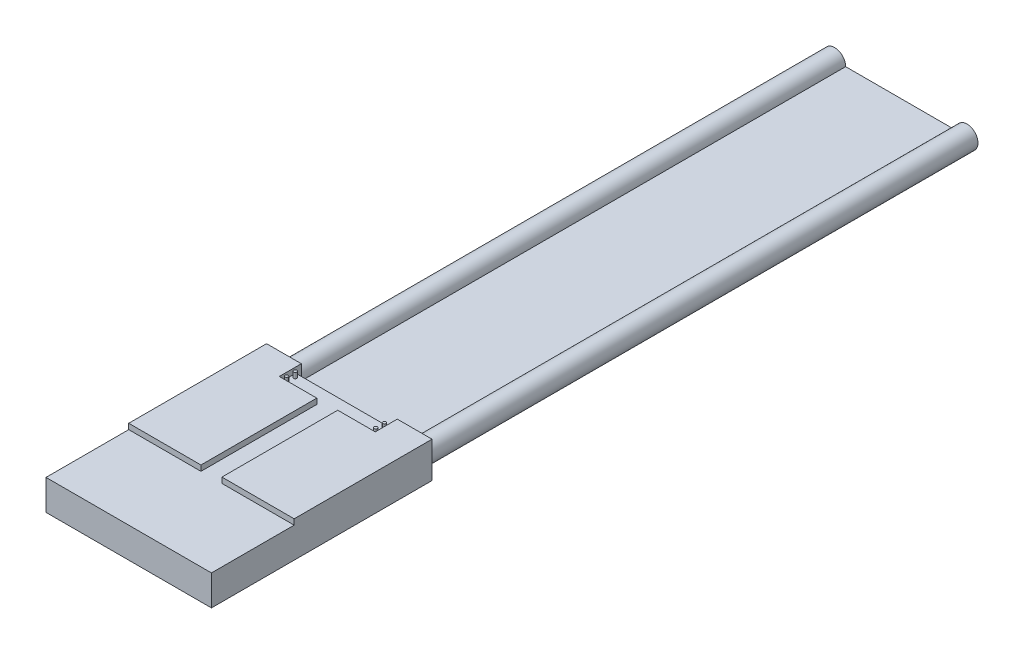
from build123d import *

# Parameters (mm, degrees)
SKETCH1_W            = 30
SKETCH1_H            = 5.5
BOSS_EXTRUDE1_DEPTH  = 25
BOSS_EXTRUDE3_DEPTH  = 100
SKETCH5_R            = 0.2875
BOSS_EXTRUDE9_DEPTH  = 1
SKETCH5_10_W         = 17.4
SKETCH5_10_H         = 1
CUT_EXTRUDE1_DEPTH   = 3
SKETCH1_5_W          = 30
SKETCH1_5_H          = 5.5
BOSS_EXTRUDE11_DEPTH = 15


with BuildPart() as part:
    # Sketch1 → Boss-Extrude1 (new body)
    with BuildSketch(Plane.XY):
        with Locations((-15, 2.75)):
            Rectangle(SKETCH1_W, SKETCH1_H)
    extrude(amount=-BOSS_EXTRUDE1_DEPTH)

    # Sketch3 → Boss-Extrude3 (add)
    with BuildSketch(Plane(origin=(0, 0, -25), x_dir=(-1, 0, 0), z_dir=(0, 0, -1))):
        with BuildLine():
            ThreePointArc((5, 2.5), (1.585786438, 3.914213562), (3, 0.5))
            Line((3, 0.5), (3, 0))
            Line((3, 0), (26.984705643, 0))
            Line((26.984705643, 0), (26.984705643, 0.50005848))
            ThreePointArc((26.984705643, 0.50005848), (28.419610636, 3.908795813), (25, 2.5))
            Line((25, 2.5), (5, 2.5))
        make_face()
    extrude(amount=BOSS_EXTRUDE3_DEPTH)

    # Sketch5 → Boss-Extrude9 (add)
    with BuildSketch(Plane(origin=(0, 5.5, 0), x_dir=(1, 0, 0), z_dir=(0, 1, 0))):
        Polygon((-6.3, 25), (-6.3, 21), (-13.1, 21), (-13.1, 0), (0, 0), (0, 25), align=None)
        Polygon((-16.9, 0), (-16.9, 21), (-23.7, 21), (-23.7, 25), (-30, 25), (-30, 0), align=None)
        with Locations((-6.9125, 21.7125)):
            Circle(SKETCH5_R)
        with Locations((-6.9125, 23.2875)):
            Circle(SKETCH5_R)
        with Locations((-23.0875, 21.7125)):
            Circle(SKETCH5_R)
        with Locations((-23.0875, 23.2875)):
            Circle(SKETCH5_R)
    extrude(amount=BOSS_EXTRUDE9_DEPTH)

    # Sketch5<10> → Cut-Extrude1 (cut)
    with BuildSketch(Plane(origin=(0, 5.5, 0), x_dir=(1, 0, 0), z_dir=(0, 1, 0))):
        with Locations((-15, 24.5)):
            Rectangle(SKETCH5_10_W, SKETCH5_10_H)
    extrude(amount=-CUT_EXTRUDE1_DEPTH, mode=Mode.SUBTRACT)

    # Sketch1<5> → Boss-Extrude11 (add)
    with BuildSketch(Plane.XY):
        with Locations((-15, 2.75)):
            Rectangle(SKETCH1_5_W, SKETCH1_5_H)
    extrude(amount=BOSS_EXTRUDE11_DEPTH)


solid = part.part
